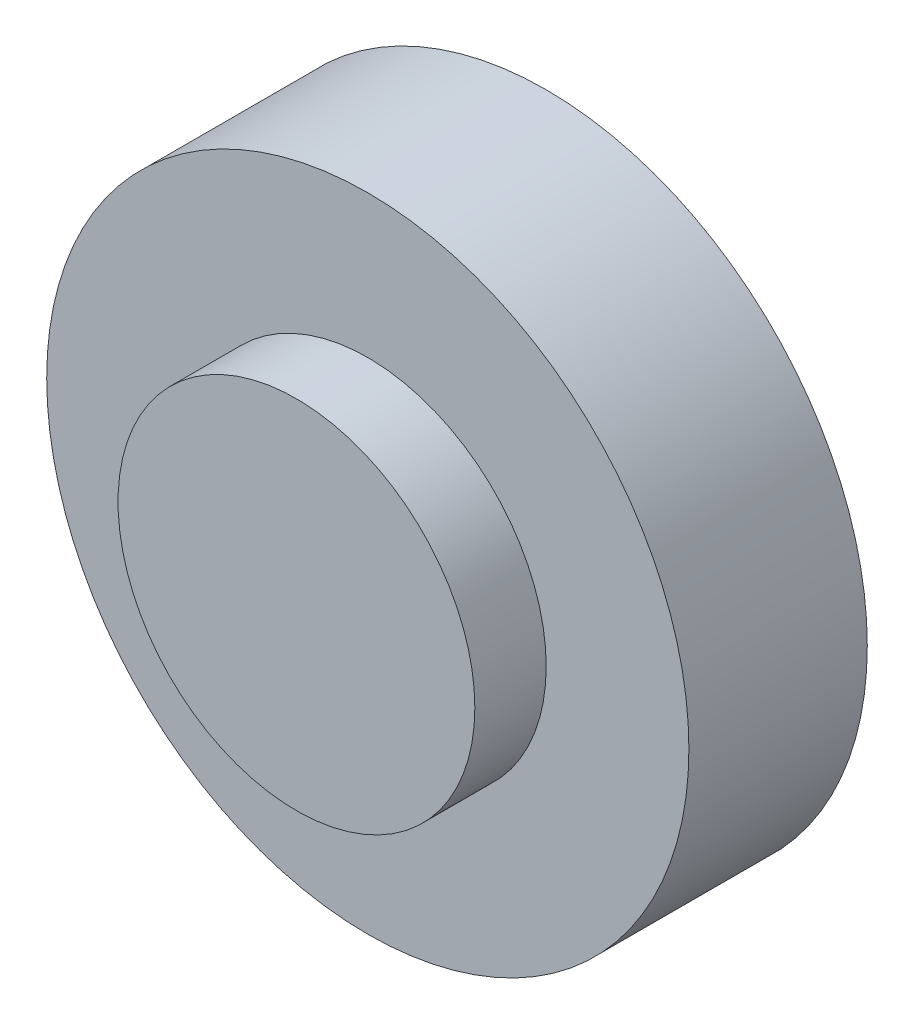
from build123d import *

# Parameters (mm, degrees)
SKETCH_1_R          = 45
EXTRUDE_1_DEPTH     = 35
SKETCH_4_R          = 12.5
CUT_EXTRUDE_3_DEPTH = 25
CUT_EXTRUDE_START   = -10
SKETCH_5_R          = 45
SKETCH_5_R_2        = 25
CUT_EXTRUDE_4_DEPTH = 10
SKETCH_6_R          = 25
CUT_EXTRUDE_6_DEPTH = 20


with BuildPart() as part:
    # Эскиз1 → Вытянуть1 (new body)
    with BuildSketch(Plane.XY):
        Circle(SKETCH_1_R)
    extrude(amount=EXTRUDE_1_DEPTH)

    # Эскиз4 → Вытянуть3 (cut)
    with BuildSketch(Plane(origin=(0, 0, 0), x_dir=(-1, 0, 0), z_dir=(0, 0, -1))):
        Circle(SKETCH_4_R)
    extrude(amount=-CUT_EXTRUDE_3_DEPTH, mode=Mode.SUBTRACT)

    # Эскиз5 → Вытянуть4 (cut)
    with BuildSketch(Plane.XY.offset(35).offset(CUT_EXTRUDE_START)):
        Circle(SKETCH_5_R)
        Circle(SKETCH_5_R_2, mode=Mode.SUBTRACT)
    extrude(amount=CUT_EXTRUDE_4_DEPTH, mode=Mode.SUBTRACT)

    # Эскиз6 → Вытянуть6 (cut)
    with BuildSketch(Plane(origin=(0, 0, 0), x_dir=(-1, 0, 0), z_dir=(0, 0, -1))):
        with Locations(Location((0, 0, 0), (0, 0, 180))):
            Circle(SKETCH_6_R)
    extrude(amount=-CUT_EXTRUDE_6_DEPTH, mode=Mode.SUBTRACT)


solid = part.part
